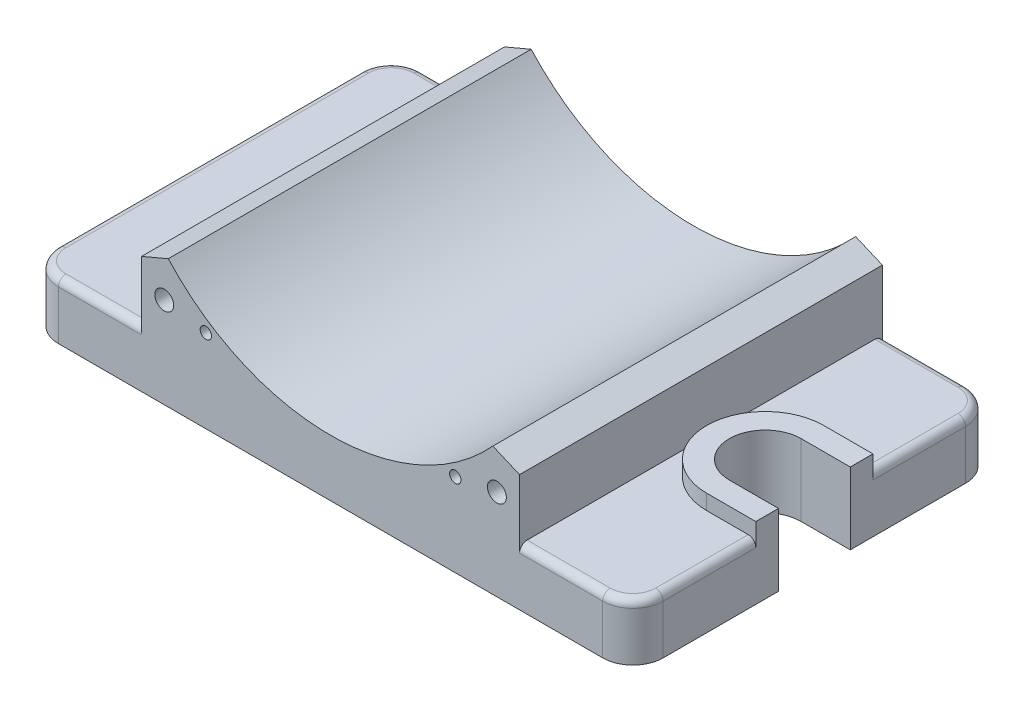
from build123d import *
from build123d.topology import SkipClean

# Parameters (mm, degrees)
EXTRUDE_1_DEPTH           = 15
EXTRUDE_2_DEPTH           = 48
HOLE_WIZARD_M6_1_D        = 5
HOLE_WIZARD_M6_1_DEPTH    = 19
HOLE_WIZARD_M6_1_TIP      = 1.502151548
HOLE_WIZARD_3_0_3_1_D     = 3
HOLE_WIZARD_3_0_3_1_DEPTH = 9
HOLE_WIZARD_3_0_3_1_TIP   = 0.901290929
FILLET_1_R                = 2
EXTRUDE_3_DEPTH           = 19
CUT_EXTRUDE_4_DEPTH       = 100.297532698


with BuildPart() as part:
    # 草圖1 → 伸長1 (new body)
    with BuildSketch(Plane(origin=(0, 0, 0), x_dir=(1, 0, 0), z_dir=(0, 1, 0))):
        with BuildLine():
            Line((-72, 48), (72, 48))
            ThreePointArc((72, 48), (77.656854249, 45.656854249), (80, 40))
            Line((80, 40), (80, -40))
            ThreePointArc((80, -40), (77.656854249, -45.656854249), (72, -48))
            Line((72, -48), (-72, -48))
            ThreePointArc((-72, -48), (-77.656854249, -45.656854249), (-80, -40))
            Line((-80, -40), (-80, 40))
            ThreePointArc((-80, 40), (-77.656854249, 45.656854249), (-72, 48))
        make_face()
    extrude(amount=EXTRUDE_1_DEPTH)

    # 草圖3 → 伸長2 (add, symmetric)
    with BuildSketch(Plane.XY):
        with BuildLine():
            Line((50, 15), (50, 31))
            Line((50, 31), (42.930175867, 34))
            ThreePointArc((42.930175867, 34), (23.473389189, 19.962277575), (0, 15))
            Line((0, 15), (50, 15))
        make_face()
    extrude_2 = extrude(amount=EXTRUDE_2_DEPTH, both=True)

    # 鏡射1: 伸長2 across plane
    add(extrude_2.mirror(Plane(origin=(0, 0, 0), x_dir=(0, 0, 1), z_dir=(1, 0, 0))))

    # M6 螺紋孔1
    with Locations(Plane.XY.offset(48)):
        with Locations((44, 24), (-44, 24)):
            Hole(HOLE_WIZARD_M6_1_D / 2, depth=HOLE_WIZARD_M6_1_DEPTH)
            with Locations((0, 0, -(HOLE_WIZARD_M6_1_DEPTH + HOLE_WIZARD_M6_1_TIP / 2))):  # 118° drill point
                Cone(0, HOLE_WIZARD_M6_1_D / 2, HOLE_WIZARD_M6_1_TIP, mode=Mode.SUBTRACT)

    # Ø3.0 (3) 直徑孔1
    with Locations(Plane.XY.offset(48)):
        with Locations((33, 22), (-33, 22)):
            Hole(HOLE_WIZARD_3_0_3_1_D / 2, depth=HOLE_WIZARD_3_0_3_1_DEPTH)
            with Locations((0, 0, -(HOLE_WIZARD_3_0_3_1_DEPTH + HOLE_WIZARD_3_0_3_1_TIP / 2))):  # 118° drill point
                Cone(0, HOLE_WIZARD_3_0_3_1_D / 2, HOLE_WIZARD_3_0_3_1_TIP, mode=Mode.SUBTRACT)

    # 圓角1
    fillet_1_edges = [part.edges().sort_by_distance(p)[0] for p in [
        (-77.656854249, 15, -45.656854249),
        (-80, 15, 0),
        (-77.656854249, 15, 45.656854249),
        (-61, 15, 48),
        (77.656854249, 15, 45.656854249),
        (61, 15, 48),
        (80, 15, 0),
        (-61, 15, -48),
        (77.656854249, 15, -45.656854249),
        (61, 15, -48),
    ]]
    fillet(fillet_1_edges, radius=FILLET_1_R)

    # 草圖2 → 伸長3 (add)
    with BuildSketch(Plane(origin=(0, 0, 0), x_dir=(1, 0, 0), z_dir=(0, 1, 0))):
        with BuildLine():
            Line((67, 9.5), (80, 9.5))
            Line((80, 9.5), (80, 15.5))
            Line((80, 15.5), (67, 15.5))
            ThreePointArc((67, 15.5), (51.5, 0), (67, -15.5))
            Line((67, -15.5), (80, -15.5))
            Line((80, -15.5), (80, -9.5))
            Line((80, -9.5), (67, -9.5))
            ThreePointArc((67, -9.5), (57.5, 0), (67, 9.5))
        make_face()
    extrude(amount=EXTRUDE_3_DEPTH)

    # 草圖2<3> → 伸長4 (cut, through all)
    with SkipClean():  # the faces are left unmerged after this step: merging them gives an invalid solid
        with BuildSketch(Plane(origin=(0, 0, 0), x_dir=(1, 0, 0), z_dir=(0, 1, 0))):
            with BuildLine():
                Line((80, -9.5), (80, 9.5))
                Line((80, 9.5), (67, 9.5))
                ThreePointArc((67, 9.5), (57.5, 0), (67, -9.5))
                Line((67, -9.5), (80, -9.5))
            make_face()
        extrude(amount=CUT_EXTRUDE_4_DEPTH, mode=Mode.SUBTRACT)


solid = part.part
